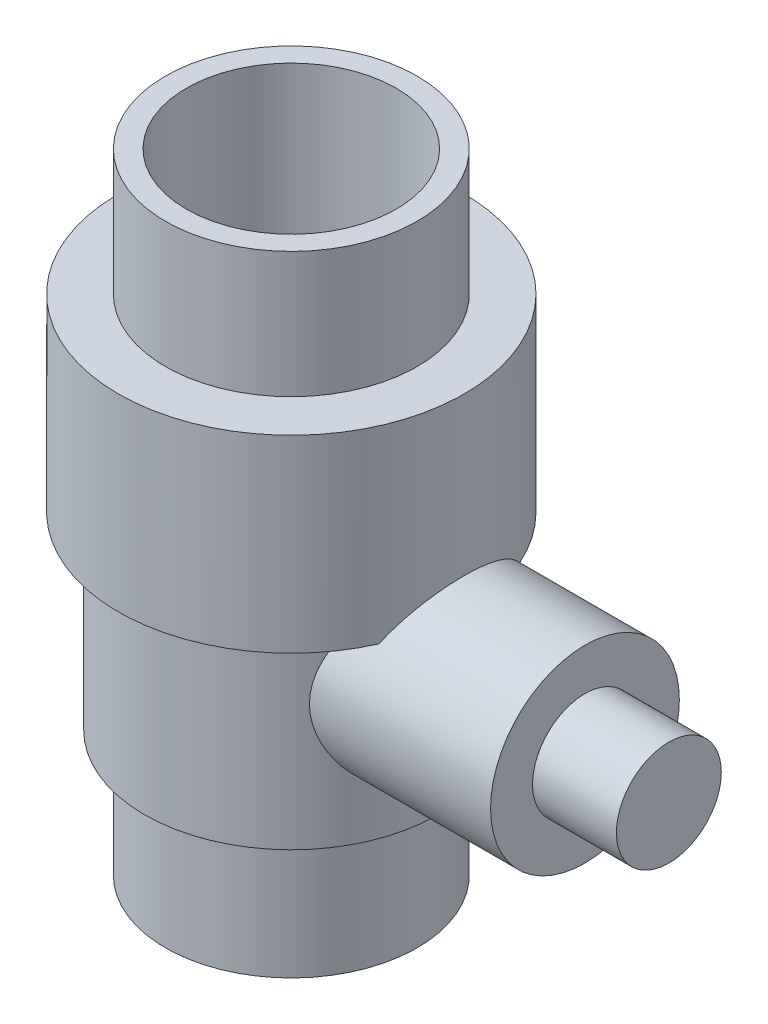
from build123d import *

# Parameters (mm, degrees)
SKETCH1_R                = 10.4775
BOSS_EXTRUDE1_DEPTH      = 11.43
SKETCH2_R                = 8.89
BOSS_EXTRUDE2_DEPTH      = 11.43
BOSS_EXTRUDE3_DEPTH      = 7.62
BOSS_EXTRUDE3_DEPTH_BACK = 30.48
SKETCH3_R                = 7.62
SKETCH4_R                = 5.715
BOSS_EXTRUDE4_DEPTH      = 17.78
SKETCH5_R                = 3.175
BOSS_EXTRUDE5_DEPTH      = 5.08
SKETCH6_R                = 6.35
CUT_EXTRUDE1_DEPTH       = 46.650494065


with BuildPart() as part:
    # Sketch1 → Boss-Extrude1 (new body)
    with BuildSketch(Plane(origin=(0, 0, 0), x_dir=(1, 0, 0), z_dir=(0, 1, 0))):
        with Locations(Location((0, 0, 0), (0, 0, 270))):
            Circle(SKETCH1_R)
    extrude(amount=BOSS_EXTRUDE1_DEPTH)

    # Sketch2 → Boss-Extrude2 (add)
    with BuildSketch(Plane.XZ):
        with Locations(Location((0, 0, 0), (0, 0, 270))):
            Circle(SKETCH2_R)
    extrude(amount=BOSS_EXTRUDE2_DEPTH)

    # Sketch3 → Boss-Extrude3 (add, two sides: drawn at the far end of the back side and taken through both)
    with BuildSketch(Plane.XZ.offset(11.43).offset(-BOSS_EXTRUDE3_DEPTH_BACK)):
        with Locations(Location((0, 0, 0), (0, 0, 270))):
            Circle(SKETCH3_R)
    extrude(amount=BOSS_EXTRUDE3_DEPTH + BOSS_EXTRUDE3_DEPTH_BACK)

    # Sketch4 → Boss-Extrude4 (add)
    with BuildSketch(Plane(origin=(0, 0, 0), x_dir=(0, 0, -1), z_dir=(1, 0, 0))):
        with Locations(Location((0, -3.81, 0), (0, 0, 221.810313572))):
            Circle(SKETCH4_R)
    extrude(amount=BOSS_EXTRUDE4_DEPTH)

    # Sketch5 → Boss-Extrude5 (add)
    with BuildSketch(Plane(origin=(17.78, 0, 0), x_dir=(0, 0, -1), z_dir=(1, 0, 0))):
        with Locations((0, -3.81)):
            Circle(SKETCH5_R)
    extrude(amount=BOSS_EXTRUDE5_DEPTH)

    # Sketch6 → Cut-Extrude1 (cut, through all)
    with BuildSketch(Plane(origin=(0, 19.05, 0), x_dir=(1, 0, 0), z_dir=(0, 1, 0))):
        with Locations(Location((0, 0, 0), (0, 0, 270))):
            Circle(SKETCH6_R)
    extrude(amount=-CUT_EXTRUDE1_DEPTH, mode=Mode.SUBTRACT)


solid = part.part
